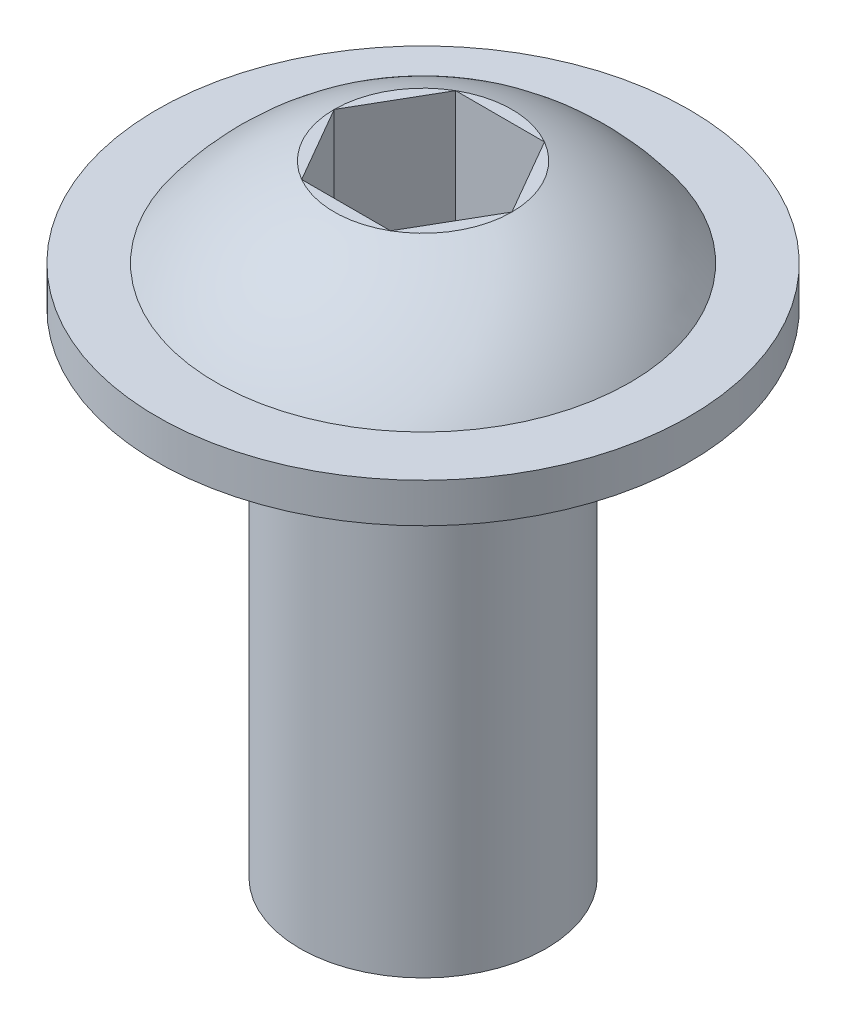
from build123d import *

# Parameters (mm, degrees)
HEX_CUT_DEPTH = 3.175


with BuildPart() as part:
    # Sketch1 → Screw revolve (revolve)
    with BuildSketch(Plane.XY, mode=Mode.PRIVATE) as screw_revolve_sk:
        with BuildLine():
            Line((0, 0), (3.175, 0))
            Line((3.175, 0), (3.175, 12.7))
            Line((3.175, 12.7), (6.858, 12.7))
            Line((6.858, 12.7), (6.858, 13.716))
            Line((6.858, 13.716), (5.334, 13.716))
            ThreePointArc((5.334, 13.716), (3.980323293, 15.082132143), (2.291358881, 16.002))
            Line((2.291358881, 16.002), (0, 16.002))
            Line((0, 16.002), (0, 0))
        make_face()
    revolve(screw_revolve_sk.sketch.rotate(Axis((0, 0, 0), (0, 1, 0)), 90), axis=Axis((0, 0, 0), (0, 1, 0)))

    # Sketch2 → Hex Cut (cut)
    with BuildSketch(Plane(origin=(0, 16.002, 0), x_dir=(-1, 0, 0), z_dir=(0, 1, 0))):
        Polygon((-2.291358881, 0), (-1.14567944, -1.984375), (1.14567944, -1.984375), (2.291358881, 0), (1.14567944, 1.984375), (-1.14567944, 1.984375), align=None)
    extrude(amount=-HEX_CUT_DEPTH, mode=Mode.SUBTRACT)


solid = part.part
